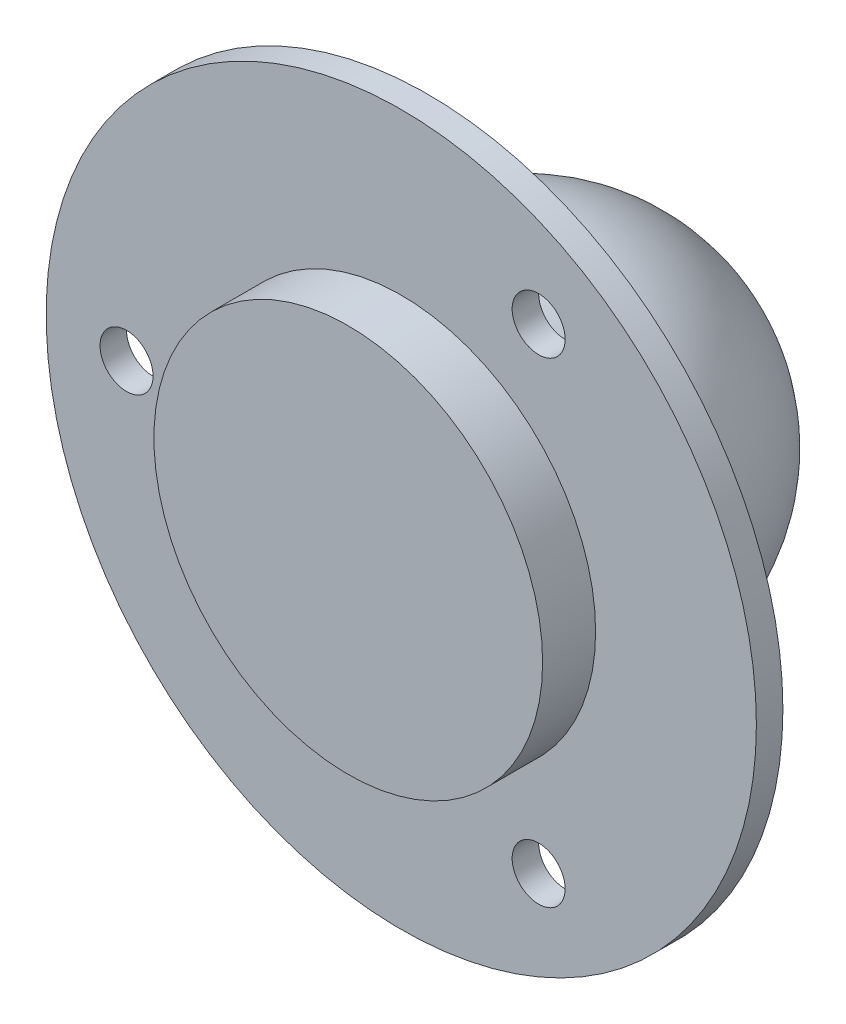
from build123d import *

# Parameters (mm, degrees)
SKETCH2_R                = 20.1
BOSS_EXTRUDE1_DEPTH      = 1.5
BOSS_EXTRUDE2_DEPTH      = 3
BOSS_EXTRUDE2_DEPTH_BACK = 18
SKETCH3_R                = 11
SKETCH4_R                = 1.5
CUT_EXTRUDE1_DEPTH       = 34.6455049
FILLET2_R                = 11


with BuildPart() as part:
    # Sketch2 → Boss-Extrude1 (new body)
    with BuildSketch(Plane.XY):
        Circle(SKETCH2_R)
    extrude(amount=BOSS_EXTRUDE1_DEPTH)

    # Sketch3 → Boss-Extrude2 (add, two sides: drawn at the far end of the back side and taken through both)
    with BuildSketch(Plane.XY.offset(1.5).offset(-BOSS_EXTRUDE2_DEPTH_BACK)):
        Circle(SKETCH3_R)
    extrude(amount=BOSS_EXTRUDE2_DEPTH + BOSS_EXTRUDE2_DEPTH_BACK)

    # Sketch4 → Cut-Extrude1 (cut, through all)
    with BuildSketch(Plane.XY.offset(1.5)):
        with Locations((-15.55, 0)):
            Circle(SKETCH4_R)
        with Locations((7.775, 13.466695029)):
            Circle(SKETCH4_R)
        with Locations((7.775, -13.466695029)):
            Circle(SKETCH4_R)
    extrude(amount=-CUT_EXTRUDE1_DEPTH, mode=Mode.SUBTRACT)

    # Fillet2
    fillet2_edges = [part.edges().sort_by_distance(p)[0] for p in [
        (-11, 0, -16.5),
    ]]
    fillet(fillet2_edges, radius=FILLET2_R)


solid = part.part
